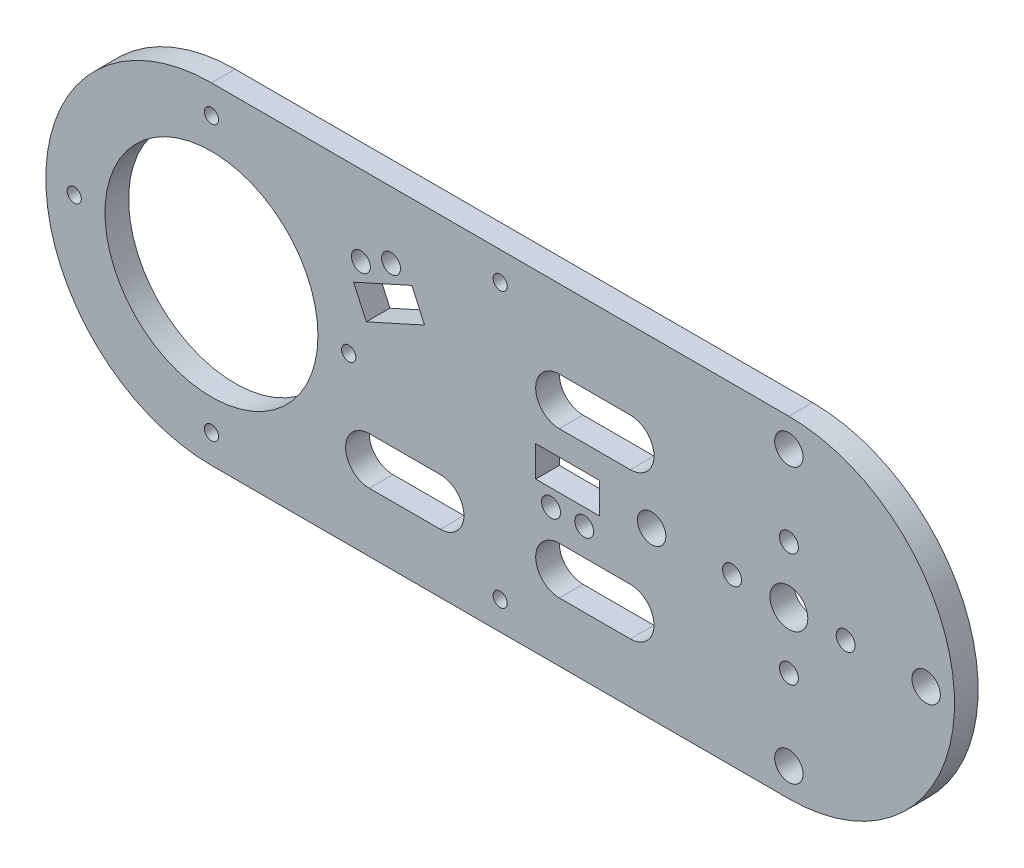
from build123d import *

# Parameters (mm, degrees)
SKETCH1_R           = 4
SKETCH1_R_2         = 22.5
SKETCH1_R_3         = 1.5
SKETCH1_R_4         = 3
SKETCH1_R_5         = 2
SKETCH1_W           = 13.5
SKETCH1_H           = 6.5
BOSS_EXTRUDE1_DEPTH = 5


with BuildPart() as part:
    # Sketch1 → Boss-Extrude1 (new body)
    with BuildSketch(Plane.XY):
        with BuildLine():
            Line((61, -35), (-61, -35))
            ThreePointArc((-61, -35), (-96, 0), (-61, 35))
            Line((-61, 35), (61, 35))
            ThreePointArc((61, 35), (96, 0), (61, -35))
        make_face()
        with Locations((61, 0)):
            Circle(SKETCH1_R, mode=Mode.SUBTRACT)
        with Locations((-61, 0)):
            Circle(SKETCH1_R_2, mode=Mode.SUBTRACT)
        with Locations((-61, -29)):
            Circle(SKETCH1_R_3, mode=Mode.SUBTRACT)
        with Locations((-61, 29)):
            Circle(SKETCH1_R_3, mode=Mode.SUBTRACT)
        with Locations((61, 29)):
            Circle(SKETCH1_R_4, mode=Mode.SUBTRACT)
        with Locations((61, -29)):
            Circle(SKETCH1_R_4, mode=Mode.SUBTRACT)
        with Locations((0, -29)):
            Circle(SKETCH1_R_3, mode=Mode.SUBTRACT)
        with Locations((0, 29)):
            Circle(SKETCH1_R_3, mode=Mode.SUBTRACT)
        with Locations((-90, 0)):
            Circle(SKETCH1_R_3, mode=Mode.SUBTRACT)
        with Locations((-32, 0)):
            Circle(SKETCH1_R_3, mode=Mode.SUBTRACT)
        with Locations((90, 0)):
            Circle(SKETCH1_R_4, mode=Mode.SUBTRACT)
        with Locations((32, 0)):
            Circle(SKETCH1_R_4, mode=Mode.SUBTRACT)
        with Locations((61, 12)):
            Circle(SKETCH1_R_5, mode=Mode.SUBTRACT)
        with Locations((61, -12)):
            Circle(SKETCH1_R_5, mode=Mode.SUBTRACT)
        with Locations((49, 0)):
            Circle(SKETCH1_R_5, mode=Mode.SUBTRACT)
        with Locations((73, 0)):
            Circle(SKETCH1_R_5, mode=Mode.SUBTRACT)
        with Locations((10.75, -6.75)):
            Circle(SKETCH1_R_5, mode=Mode.SUBTRACT)
        with Locations((17.75, -6.75)):
            Circle(SKETCH1_R_5, mode=Mode.SUBTRACT)
        with Locations((-23.054905042, 20.964824554)):
            Circle(SKETCH1_R_5, mode=Mode.SUBTRACT)
        with Locations((-29.435230641, 18.085337577)):
            Circle(SKETCH1_R_5, mode=Mode.SUBTRACT)
        with Locations((14.25, 0)):
            Rectangle(SKETCH1_W, SKETCH1_H, mode=Mode.SUBTRACT)
        with BuildLine():
            Line((-27.66, -12.5), (-12.66, -12.5))
            ThreePointArc((-12.66, -12.5), (-7.66, -17.5), (-12.66, -22.5))
            Line((-12.66, -22.5), (-27.66, -22.5))
            ThreePointArc((-27.66, -22.5), (-32.66, -17.5), (-27.66, -12.5))
        make_face(mode=Mode.SUBTRACT)
        with BuildLine():
            Line((12.5, -12.5), (27.5, -12.5))
            ThreePointArc((27.5, -12.5), (32.5, -17.5), (27.5, -22.5))
            Line((27.5, -22.5), (12.5, -22.5))
            ThreePointArc((12.5, -22.5), (7.5, -17.5), (12.5, -12.5))
        make_face(mode=Mode.SUBTRACT)
        with BuildLine():
            Line((12.5, 18.47), (27.5, 18.47))
            ThreePointArc((27.5, 18.47), (32.5, 13.47), (27.5, 8.47))
            Line((27.5, 8.47), (12.5, 8.47))
            ThreePointArc((12.5, 8.47), (7.5, 13.47), (12.5, 18.47))
        make_face(mode=Mode.SUBTRACT)
        Polygon((-30.95778118, 13.55827011), (-28.283971844, 7.633682054), (-15.979058189, 13.186978367), (-18.652867525, 19.111566423), align=None, mode=Mode.SUBTRACT)
    extrude(amount=BOSS_EXTRUDE1_DEPTH)


solid = part.part
